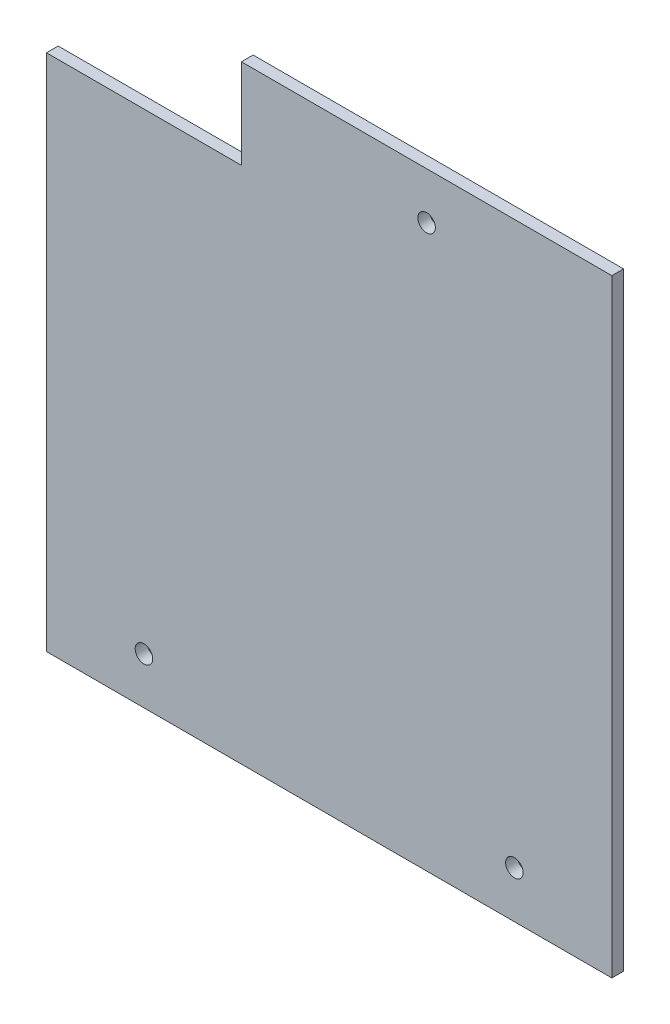
from build123d import *

# Parameters (mm, degrees)
SKIZZE1_W                       = 145
SKIZZE1_H                       = 156
AUFSATZ_LINEAR_AUSTRAGEN1_DEPTH = 3
DURCHGANGSLOCH_F_R_M41_D        = 4.5
DURCHGANGSLOCH_F_R_M41_DEPTH    = 3
DURCHGANGSLOCH_F_R_M41_TIP      = 1.351936393
SKIZZE5_W                       = 50
SKIZZE5_H                       = 23
SCHNITT_LINEAR_AUSTRAGEN1_DEPTH = 107.532858781


with BuildPart() as part:
    # Skizze1 → Aufsatz-Linear austragen1 (new body)
    with BuildSketch(Plane.XY):
        Rectangle(SKIZZE1_W, SKIZZE1_H)
    extrude(amount=AUFSATZ_LINEAR_AUSTRAGEN1_DEPTH)

    # Durchgangsloch für M41
    with Locations(Plane.XY.offset(3)):
        with Locations((25, 66), (-47.5, -66), (47.5, -66)):
            Hole(DURCHGANGSLOCH_F_R_M41_D / 2, depth=DURCHGANGSLOCH_F_R_M41_DEPTH)
            with Locations((0, 0, -(DURCHGANGSLOCH_F_R_M41_DEPTH + DURCHGANGSLOCH_F_R_M41_TIP / 2))):  # 118° drill point
                Cone(0, DURCHGANGSLOCH_F_R_M41_D / 2, DURCHGANGSLOCH_F_R_M41_TIP, mode=Mode.SUBTRACT)

    # Skizze5 → Schnitt-Linear austragen1 (cut, through all)
    with BuildSketch(Plane(origin=(0, 0, 0), x_dir=(-1, 0, 0), z_dir=(0, 0, -1))):
        with Locations((47.5, 66.5)):
            Rectangle(SKIZZE5_W, SKIZZE5_H)
    extrude(amount=-SCHNITT_LINEAR_AUSTRAGEN1_DEPTH, mode=Mode.SUBTRACT)


solid = part.part
